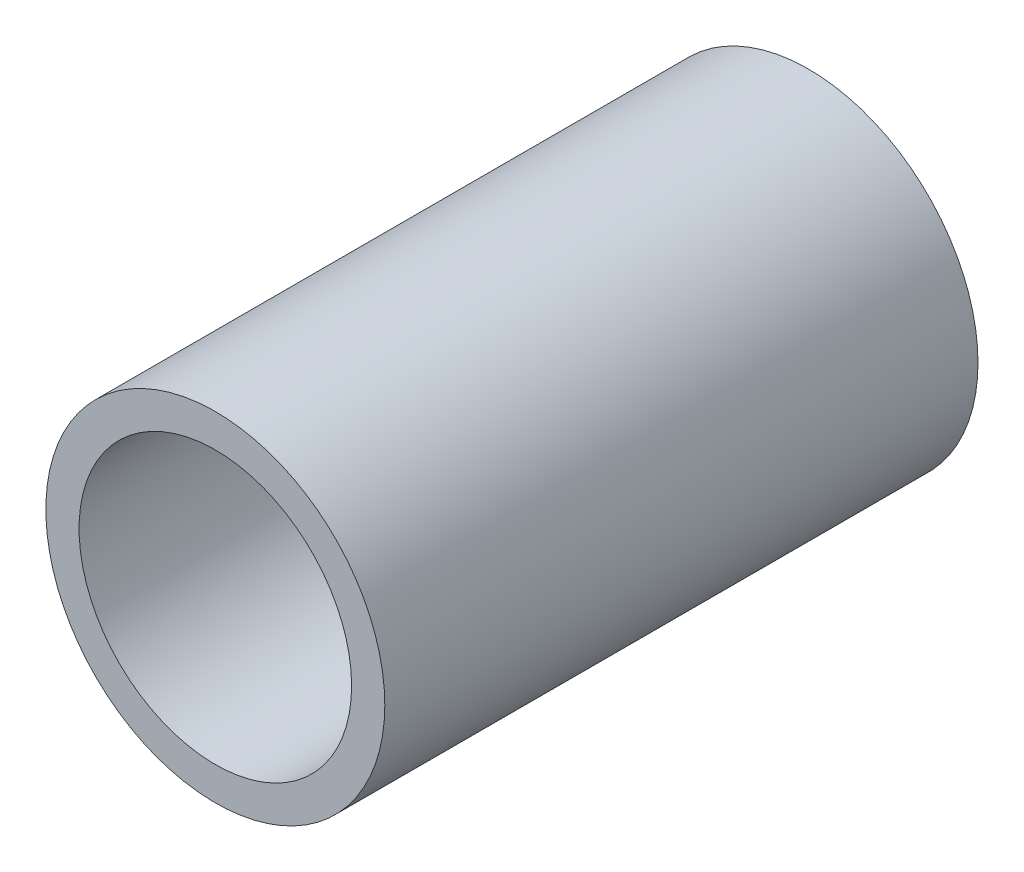
from build123d import *

# Parameters (mm, degrees)
SKETCH1_R           = 20
BOSS_EXTRUDE1_DEPTH = 70
SKETCH2_R           = 16.081289486
CUT_EXTRUDE1_DEPTH  = 60


with BuildPart() as part:
    # Sketch1 → Boss-Extrude1 (new body)
    with BuildSketch(Plane.XY):
        Circle(SKETCH1_R)
    extrude(amount=BOSS_EXTRUDE1_DEPTH)

    # Sketch2 → Cut-Extrude1 (cut)
    with BuildSketch(Plane.XY.offset(70)):
        Circle(SKETCH2_R)
    extrude(amount=-CUT_EXTRUDE1_DEPTH, mode=Mode.SUBTRACT)


solid = part.part
